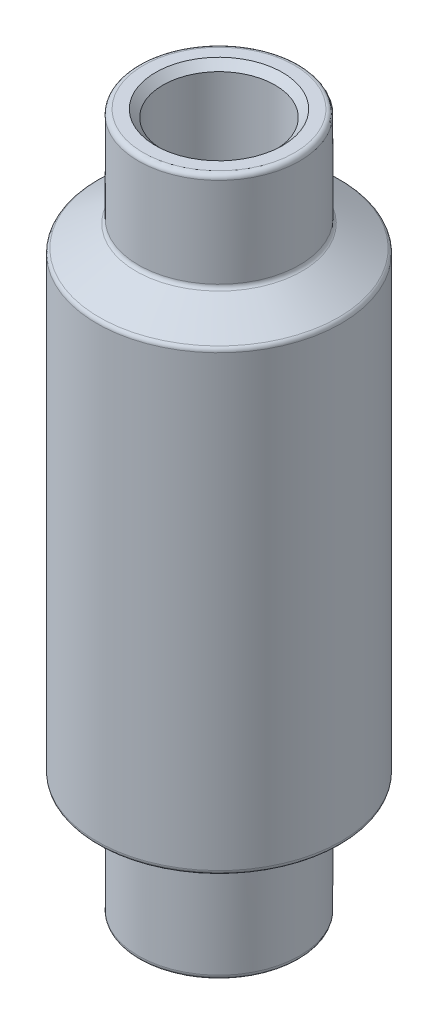
from build123d import *

# Parameters (mm, degrees)
SKETCH2_R          = 11.5
CUT_EXTRUDE1_DEPTH = 34
FILLET1_R          = 1
FILLET2_R          = 1
FILLET3_R          = 1
FILLET5_R          = 1
CHAMFER1_SIZE      = 1.5


with BuildPart() as part:
    # Sketch1 → Revolve2 (revolve)
    with BuildSketch(Plane.XY, mode=Mode.PRIVATE) as revolve2_sk:
        Polygon((16.5, 71.5), (0, 71.5), (0, 0), (25, 0), (25, 46.5), (16.5, 51.5), align=None)
        Polygon((25, 0), (0, 0), (0, -71.5), (16.5, -71.5), (16.5, -51.5), (25, -46.5), align=None)
    revolve(revolve2_sk.sketch.rotate(Axis((0, 71.5, 0), (0, -1, 0)), 180), axis=Axis((0, 71.5, 0), (0, -1, 0)))

    # Sketch2 → Cut-Extrude1 (cut)
    with BuildSketch(Plane(origin=(0, 71.5, 0), x_dir=(1, 0, 0), z_dir=(0, 1, 0))):
        with Locations(Location((0, 0, 0), (0, 0, 180))):
            Circle(SKETCH2_R)
    cut_extrude1 = extrude(amount=-CUT_EXTRUDE1_DEPTH, mode=Mode.SUBTRACT)

    # Mirror1: Cut-Extrude1 across plane
    add(cut_extrude1.mirror(Plane.ZX), mode=Mode.SUBTRACT)

    # Fillet1
    fillet1_edges = [part.edges().sort_by_distance(p)[0] for p in [
        (25, 46.5, 0),
    ]]
    fillet(fillet1_edges, radius=FILLET1_R)

    # Fillet2
    fillet2_edges = [part.edges().sort_by_distance(p)[0] for p in [
        (16.5, 51.5, 0),
    ]]
    fillet(fillet2_edges, radius=FILLET2_R)

    # Fillet3
    fillet3_edges = [part.edges().sort_by_distance(p)[0] for p in [
        (25, -46.5, 0),
        (16.5, -51.5, 0),
    ]]
    fillet(fillet3_edges, radius=FILLET3_R)

    # Fillet5
    fillet5_edges = [part.edges().sort_by_distance(p)[0] for p in [
        (16.5, 71.5, 0),
        (16.5, -71.5, 0),
    ]]
    fillet(fillet5_edges, radius=FILLET5_R)

    # Chamfer1
    chamfer1_edges = [part.edges().sort_by_distance(p)[0] for p in [
        (11.5, 71.5, 0),
        (11.5, -71.5, 0),
    ]]
    chamfer(chamfer1_edges, length=CHAMFER1_SIZE)


solid = part.part
